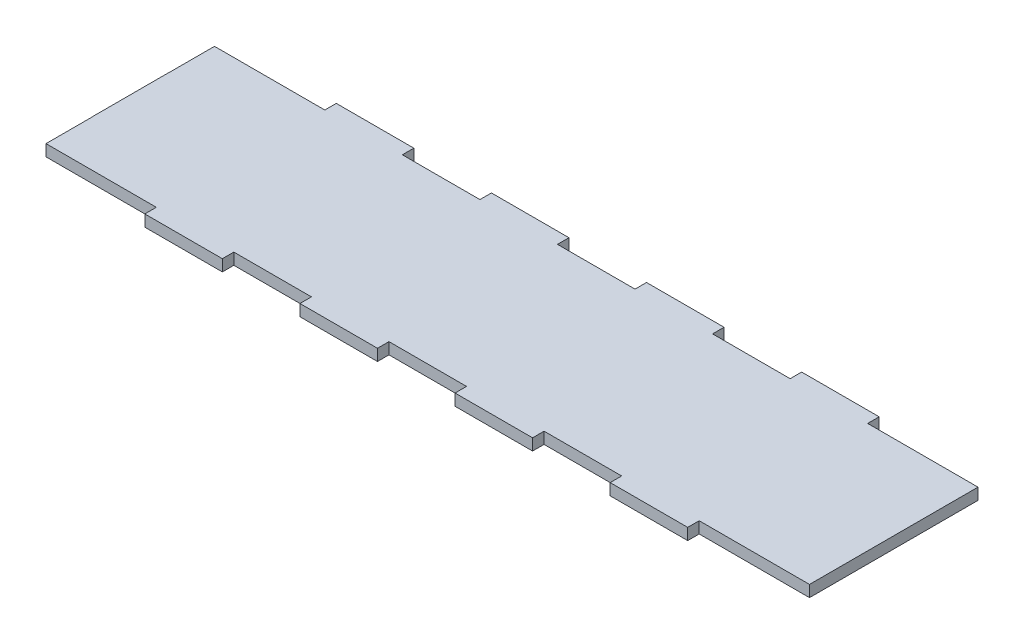
from build123d import *

# Parameters (mm, degrees)
SKETCH1_W               = 525.399648274
SKETCH1_H               = 377.876053004
BOSS_EXTRUDE1_DEPTH     = 6
CUT_EXTRUDE_THIN2_DEPTH = 324.642975299


with BuildPart() as part:
    # Sketch1 → Boss-Extrude1 (new body)
    with BuildSketch(Plane(origin=(0, 0, 0), x_dir=(1, 0, 0), z_dir=(0, 1, 0))):
        Rectangle(SKETCH1_W, SKETCH1_H)
    extrude(amount=BOSS_EXTRUDE1_DEPTH)

    # Sketch2 → Cut-Extrude-Thin2 (cut, through all)
    with BuildSketch(Plane(origin=(0, 6, 0), x_dir=(1, 0, 0), z_dir=(0, 1, 0))):
        Polygon((-187.350784755, 75.591944913), (-187.350784755, 51.841944259), (-187.411415821, 51.841944259), (-187.411415821, 11.331943142), (-187.350784755, 11.331943142), (-187.350784755, -12.418057512), (-129.745802698, -12.418057512), (-129.745802698, -18.418057678), (-89.235801582, -18.418057678), (-89.235801582, -12.418057512), (-48.745800465, -12.418057512), (-48.745800465, -18.418057678), (-8.235799349, -18.418057678), (-8.235799349, -12.418057512), (32.254201767, -12.418057512), (32.254201767, -18.418057678), (72.764202884, -18.418057678), (72.764202884, -12.418057512), (113.254204, -12.418057512), (113.254204, -18.418057678), (153.764205117, -18.418057678), (153.764205117, -12.418057512), (194.259206233, -12.418057512), (211.369187173, -12.418057512), (211.369187173, 11.336943142), (211.369187173, 51.836944259), (211.369187173, 75.591944913), (153.764205117, 75.591944913), (153.764205117, 81.591945079), (113.254204, 81.591945079), (113.254204, 75.591944913), (72.764202884, 75.591944913), (72.764202884, 81.591945079), (32.254201767, 81.591945079), (32.254201767, 75.591944913), (-8.235799349, 75.591944913), (-8.235799349, 81.591945079), (-48.745800465, 81.591945079), (-48.745800465, 75.591944913), (-89.235801582, 75.591944913), (-89.235801582, 81.591945079), (-129.745802698, 81.591945079), (-129.745802698, 75.591944913), (-170.240803815, 75.591944913), align=None)
        Polygon((-187.340784755, 75.581944913), (-187.340784755, 51.831944259), (-187.401415821, 51.831944259), (-187.401415821, 11.341943142), (-187.340784755, 11.341943142), (-187.340784755, -12.408057512), (-129.735802698, -12.408057512), (-129.735802698, -18.408057678), (-89.245801582, -18.408057678), (-89.245801582, -12.408057512), (-48.735800465, -12.408057512), (-48.735800465, -18.408057678), (-8.245799349, -18.408057678), (-8.245799349, -12.408057512), (32.264201767, -12.408057512), (32.264201767, -18.408057678), (72.754202884, -18.408057678), (72.754202884, -12.408057512), (113.264204, -12.408057512), (113.264204, -18.408057678), (153.754205117, -18.408057678), (153.754205117, -12.408057512), (194.259206233, -12.408057512), (211.359187173, -12.408057512), (211.359187173, 11.336943142), (211.359187173, 51.836944259), (211.359187173, 75.581944913), (153.754205117, 75.581944913), (153.754205117, 81.581945079), (113.264204, 81.581945079), (113.264204, 75.581944913), (72.754202884, 75.581944913), (72.754202884, 81.581945079), (32.264201767, 81.581945079), (32.264201767, 75.581944913), (-8.245799349, 75.581944913), (-8.245799349, 81.581945079), (-48.735800465, 81.581945079), (-48.735800465, 75.581944913), (-89.245801582, 75.581944913), (-89.245801582, 81.581945079), (-129.735802698, 81.581945079), (-129.735802698, 75.581944913), (-170.240803815, 75.581944913), align=None, mode=Mode.SUBTRACT)
    extrude(amount=-CUT_EXTRUDE_THIN2_DEPTH, mode=Mode.SUBTRACT)


with BuildPart() as body_2:
    # of the pieces the cut leaves, the one that is kept (cut_extrude_thin2_keep)
    add(part.part.solids().sort_by_distance((-129.735802698, 0, -75.581944913))[0])


solid = body_2.part
